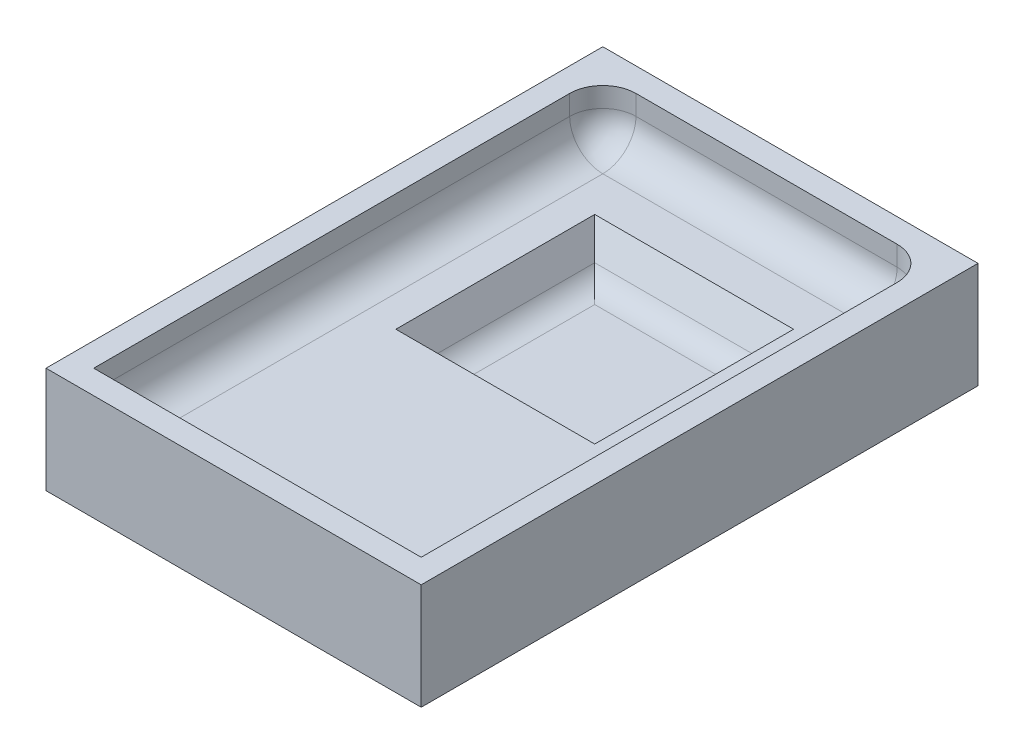
from build123d import *

# Parameters (mm, degrees)
SKETCH1_W           = 28.3
SKETCH1_H           = 42
BOSS_EXTRUDE1_DEPTH = 4
SKETCH2_W           = 15
SKETCH2_H           = 15
CUT_EXTRUDE1_DEPTH  = 3
DRAFT1_ANGLE        = 30
FILLET1_R           = 2
SKETCH4_W           = 28.3
SKETCH4_H           = 42
SKETCH4_W_2         = 24.7
SKETCH4_H_2         = 38.4
BOSS_EXTRUDE2_DEPTH = 4
FILLET2_R           = 2.5


with BuildPart() as part:
    # Sketch1 → Boss-Extrude1 (new body)
    with BuildSketch(Plane(origin=(0, 0, 0), x_dir=(1, 0, 0), z_dir=(0, 1, 0))):
        with Locations((14.15, 21)):
            Rectangle(SKETCH1_W, SKETCH1_H)
    extrude(amount=BOSS_EXTRUDE1_DEPTH)

    # Sketch2 → Cut-Extrude1 (cut)
    with BuildSketch(Plane(origin=(0, 4, 0), x_dir=(1, 0, 0), z_dir=(0, 1, 0))):
        with Locations((14.15, 27.24)):
            Rectangle(SKETCH2_W, SKETCH2_H)
    extrude(amount=-CUT_EXTRUDE1_DEPTH, mode=Mode.SUBTRACT)

    # Draft1
    draft1_faces = [part.faces().sort_by_distance(p)[0] for p in [
        (6.65, 2.5, -27.24),
        (14.15, 2.5, -19.74),
        (21.65, 2.5, -27.24),
        (14.15, 2.5, -34.74),
    ]]
    draft(draft1_faces, Plane.ZX.offset(4), DRAFT1_ANGLE)

    # Fillet1
    fillet1_edges = [part.edges().sort_by_distance(p)[0] for p in [
        (8.382050808, 1, -27.24),
        (14.15, 1, -33.007949192),
        (19.917949192, 1, -27.24),
        (14.15, 1, -21.472050808),
    ]]
    fillet(fillet1_edges, radius=FILLET1_R)

    # Sketch4 → Boss-Extrude2 (add)
    with BuildSketch(Plane(origin=(0, 4, 0), x_dir=(1, 0, 0), z_dir=(0, 1, 0))):
        with Locations((14.15, 21)):
            Rectangle(SKETCH4_W, SKETCH4_H)
        with Locations((14.15, 21)):
            Rectangle(SKETCH4_W_2, SKETCH4_H_2, mode=Mode.SUBTRACT)
    extrude(amount=BOSS_EXTRUDE2_DEPTH)

    # Fillet2
    fillet2_edges = [part.edges().sort_by_distance(p)[0] for p in [
        (1.8, 4, -21),
        (26.5, 4, -21),
        (14.15, 4, -40.2),
        (26.5, 6, -40.2),
        (1.8, 6, -40.2),
    ]]
    fillet(fillet2_edges, radius=FILLET2_R)


solid = part.part
